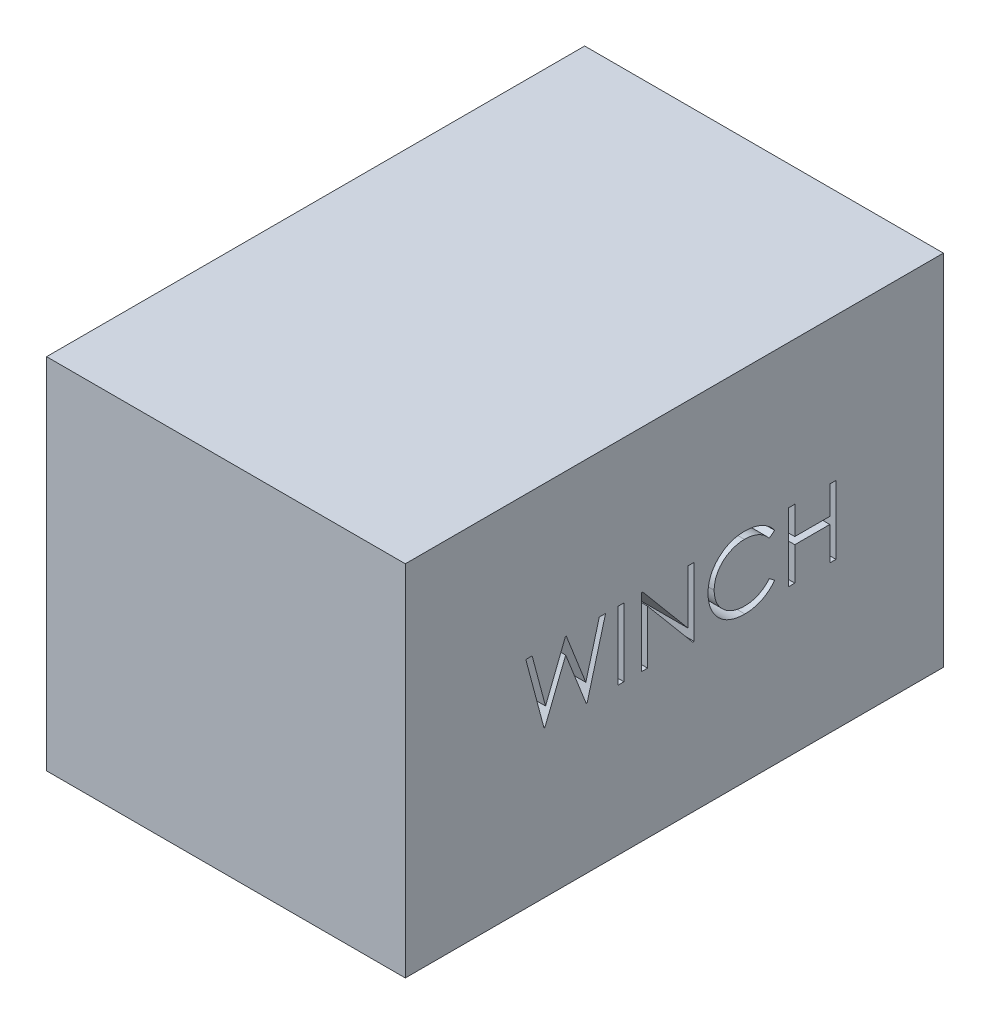
from build123d import *

# Parameters (mm, degrees)
SKETCH1_W           = 100
SKETCH1_H           = 100
BOSS_EXTRUDE1_DEPTH = 150
SKETCH2_W           = 1.709615385
SKETCH2_H           = 19.05
CUT_EXTRUDE1_DEPTH  = 30


with BuildPart() as part:
    # Sketch1 → Boss-Extrude1 (new body)
    with BuildSketch(Plane.XY):
        with Locations((-5.555555556, 7.828282828)):
            Rectangle(SKETCH1_W, SKETCH1_H)
    extrude(amount=BOSS_EXTRUDE1_DEPTH)

    # Sketch2 → Cut-Extrude1 (cut)
    with BuildSketch(Plane(origin=(44.444444444, 0, 0), x_dir=(0, 0, -1), z_dir=(1, 0, 0))):
        Polygon((-116.409832449, 17.921320019), (-114.646791584, 17.921320019), (-110.914640142, 3.939108481), (-105.373654565, 17.921320019), (-105.12560769, 17.921320019), (-99.680024757, 4.045959442), (-95.932608892, 17.921320019), (-94.184832449, 17.921320019), (-99.321310815, -1.128679981), (-99.565541584, -1.128679981), (-105.297332449, 13.433579635), (-111.090181007, -1.128679981), (-111.338227882, -1.128679981), align=None)
        with Locations((-89.910793987, 8.396320019)):
            Rectangle(SKETCH2_W, SKETCH2_H)
        Polygon((-84.171370911, -1.128679981), (-84.171370911, 17.921320019), (-83.812656969, 17.921320019), (-71.227140142, 2.927840452), (-71.227140142, 17.921320019), (-69.517524757, 17.921320019), (-69.517524757, -1.128679981), (-69.906767545, -1.128679981), (-82.461755526, 13.830454635), (-82.461755526, -1.128679981), align=None)
        with BuildLine():
            Line((-47.048293988, 14.425767135), (-48.544207449, 13.280935404))
            add(Edge.make_bspline(
                [(-48.544207449, 13.280935404), (-48.650919499, 13.40811304), (-48.862904888, 13.660753681), (-49.203949976, 14.01551663), (-49.559377489, 14.347886125), (-49.929051563, 14.659445498), (-50.3196262, 14.939299609), (-50.721639975, 15.202032326), (-51.141817907, 15.437532443), (-51.722852348, 15.723080981), (-52.482935637, 16.021056482), (-53.439761832, 16.270901213), (-54.438586526, 16.429947897), (-55.120019175, 16.447173677), (-55.466623315, 16.455935404)],
                knots=[0, 0, 0, 0, 0.757959112, 1.505699292, 2.245454638, 2.979532153, 3.711538275, 4.438200793, 5.171680507, 5.909471876, 7.393775596, 8.890124382, 10.418191784, 12, 12, 12, 12], degree=3))
            add(Edge.make_bspline(
                [(-55.466623315, 16.455935404), (-55.657576701, 16.453736694), (-56.037711246, 16.449359679), (-56.601855081, 16.391615726), (-57.155464688, 16.31045614), (-57.698179954, 16.190031167), (-58.229310057, 16.037780197), (-58.752327274, 15.855850444), (-59.259659252, 15.630761959), (-59.758324235, 15.38197843), (-60.23609394, 15.100977623), (-60.6881507, 14.794472094), (-61.112845783, 14.465891726), (-61.510515143, 14.11400499), (-61.881565319, 13.740396605), (-62.223307682, 13.341084974), (-62.534559701, 12.917346716), (-62.821490937, 12.474769454), (-63.0784631, 12.014642331), (-63.293618587, 11.535262305), (-63.484146466, 11.044838544), (-63.634909487, 10.537830083), (-63.7542415, 10.017804458), (-63.83657921, 9.483366026), (-63.89366646, 8.935631284), (-63.898021709, 8.56437774), (-63.900217065, 8.377239491)],
                knots=[0, 0, 0, 0, 1.054917814, 2.100044995, 3.131103042, 4.146048494, 5.169673617, 6.183595914, 7.203665975, 8.234915748, 9.262203917, 10.264457458, 11.251630812, 12.227803204, 13.197192746, 14.159520551, 15.12972552, 16.100847026, 17.073214652, 18.039054194, 19.002613845, 19.979014051, 20.95965708, 21.949030935, 22.966165397, 24, 24, 24, 24], degree=3))
            add(Edge.make_bspline(
                [(-63.900217065, 8.377239491), (-63.893349164, 8.095673306), (-63.879864952, 7.542855452), (-63.759859019, 6.733118271), (-63.577495594, 5.957398604), (-63.304179382, 5.220545462), (-62.967162836, 4.513472828), (-62.541310364, 3.848144211), (-62.048097497, 3.214505482), (-61.480546728, 2.627531723), (-60.857852215, 2.09133559), (-60.189752868, 1.619164568), (-59.477912673, 1.225564993), (-58.7301913, 0.898035913), (-57.94083488, 0.646267152), (-57.111262884, 0.46902528), (-56.243279596, 0.353407126), (-55.650174719, 0.342338052), (-55.348324036, 0.336704635)],
                knots=[0, 0, 0, 0, 1.029171465, 2.020641659, 2.987623507, 3.938342917, 4.889210282, 5.84687017, 6.821220943, 7.821438502, 8.827599549, 9.822697543, 10.807740252, 11.797342354, 12.80366471, 13.83203677, 14.896651826, 16, 16, 16, 16], degree=3))
            add(Edge.make_bspline(
                [(-55.348324036, 0.336704635), (-55.015750829, 0.345896422), (-54.361167199, 0.363988057), (-53.401221227, 0.517254827), (-52.482272274, 0.765764352), (-51.60427091, 1.113551615), (-50.769692336, 1.56566411), (-49.977230513, 2.113748271), (-49.226216536, 2.763017625), (-48.7746157, 3.258770081), (-48.544207449, 3.511704635)],
                knots=[0, 0, 0, 0, 1.028121516, 2.023589091, 2.998037872, 3.967518031, 4.937445131, 5.927275754, 6.942489185, 8, 8, 8, 8], degree=3))
            Line((-48.544207449, 3.511704635), (-47.048293988, 2.378321221))
            add(Edge.make_bspline(
                [(-47.048293988, 2.378321221), (-47.1686797, 2.222990504), (-47.408874484, 1.913073096), (-47.797810262, 1.476165647), (-48.207533838, 1.065207968), (-48.641088488, 0.683513344), (-49.093486754, 0.323444039), (-49.572851768, -0.004770214), (-50.072881788, -0.305710599), (-50.591882595, -0.581265717), (-51.129302759, -0.825743875), (-51.684498326, -1.03504224), (-52.255076173, -1.215336282), (-52.841062383, -1.36366468), (-53.443672431, -1.479440151), (-54.060731725, -1.55683581), (-54.693572046, -1.609859658), (-55.120517495, -1.614692457), (-55.336875719, -1.617141519)],
                knots=[0, 0, 0, 0, 0.986787822, 1.968848986, 2.935600012, 3.899624008, 4.868462664, 5.837806735, 6.815139263, 7.798259679, 8.787526145, 9.778297419, 10.776456485, 11.791383307, 12.812564526, 13.85620153, 14.913611965, 16, 16, 16, 16], degree=3))
            add(Edge.make_bspline(
                [(-55.336875719, -1.617141519), (-55.541764821, -1.615715531), (-55.946907648, -1.612895816), (-56.545070853, -1.567218448), (-57.127399857, -1.504899166), (-57.692230321, -1.411063595), (-58.242644557, -1.300332259), (-58.773652881, -1.151898705), (-59.290480526, -0.985623955), (-59.791051066, -0.790198241), (-60.275790289, -0.569674448), (-60.743134748, -0.320437534), (-61.192869502, -0.044583385), (-61.629416149, 0.251807457), (-62.046325855, 0.578255343), (-62.447211471, 0.930226597), (-62.834320949, 1.306534912), (-63.073821277, 1.577887757), (-63.194237497, 1.714318817)],
                knots=[0, 0, 0, 0, 1.114604814, 2.203992996, 3.262667896, 4.300477797, 5.318619304, 6.316056647, 7.298880507, 8.271930387, 9.238335007, 10.195173496, 11.151986948, 12.108099108, 13.064862484, 14.031167946, 15.010108607, 16, 16, 16, 16], degree=3))
            add(Edge.make_bspline(
                [(-63.194237497, 1.714318817), (-63.387108643, 1.951307289), (-63.770522424, 2.422423098), (-64.261063644, 3.185979653), (-64.680966766, 3.98318519), (-65.020469992, 4.818227945), (-65.285878583, 5.689234153), (-65.469744801, 6.596642881), (-65.589224249, 7.539606681), (-65.602887392, 8.180975488), (-65.609832449, 8.506987087)],
                knots=[0, 0, 0, 0, 0.994628077, 1.977248131, 2.950237994, 3.925870899, 4.908910175, 5.911660606, 6.938484602, 8, 8, 8, 8], degree=3))
            add(Edge.make_bspline(
                [(-65.609832449, 8.506987087), (-65.601367753, 8.849644627), (-65.584713991, 9.523801945), (-65.44322259, 10.513171605), (-65.215608857, 11.46105279), (-64.892320077, 12.365676028), (-64.482443808, 13.231799411), (-63.976113238, 14.05280654), (-63.37921065, 14.833947978), (-62.69641746, 15.563371124), (-61.947658107, 16.230335315), (-61.145822848, 16.817109081), (-60.292481108, 17.305428704), (-59.397033944, 17.713622102), (-58.452776163, 18.02737268), (-57.461722397, 18.247009311), (-56.425734875, 18.383718186), (-55.718912244, 18.401000389), (-55.359772353, 18.409781558)],
                knots=[0, 0, 0, 0, 1.032925535, 2.032216505, 3.007276963, 3.968222605, 4.92396291, 5.891752235, 6.871517503, 7.883894988, 8.900124299, 9.891468569, 10.874487609, 11.85992873, 12.854644235, 13.869047385, 14.917252991, 16, 16, 16, 16], degree=3))
            add(Edge.make_bspline(
                [(-55.359772353, 18.409781558), (-55.140890727, 18.407157349), (-54.707636592, 18.401962991), (-54.066725727, 18.351310988), (-53.442743919, 18.266872646), (-52.835261288, 18.151940895), (-52.241322477, 18.009298188), (-51.66546688, 17.823477421), (-51.104315456, 17.611007158), (-50.561407284, 17.36630465), (-50.039347204, 17.091621386), (-49.538297813, 16.790002064), (-49.062239082, 16.461820608), (-48.607821207, 16.109868182), (-48.18264583, 15.726698881), (-47.774641211, 15.322851966), (-47.397663057, 14.886695008), (-47.164963524, 14.579691011), (-47.048293988, 14.425767135)],
                knots=[0, 0, 0, 0, 1.096760587, 2.17092713, 3.219439832, 4.250915756, 5.268269357, 6.278326846, 7.281116186, 8.274029601, 9.260640565, 10.235837813, 11.203064059, 12.156899882, 13.114053108, 14.069676657, 15.032185724, 16, 16, 16, 16], degree=3))
        make_face()
        Polygon((-43.14060168, 17.921320019), (-41.430986295, 17.921320019), (-41.430986295, 10.105935404), (-31.661755526, 10.105935404), (-31.661755526, 17.921320019), (-29.952140142, 17.921320019), (-29.952140142, -1.128679981), (-31.661755526, -1.128679981), (-31.661755526, 8.15208925), (-41.430986295, 8.15208925), (-41.430986295, -1.128679981), (-43.14060168, -1.128679981), align=None)
    extrude(amount=-CUT_EXTRUDE1_DEPTH, mode=Mode.SUBTRACT)


solid = part.part
